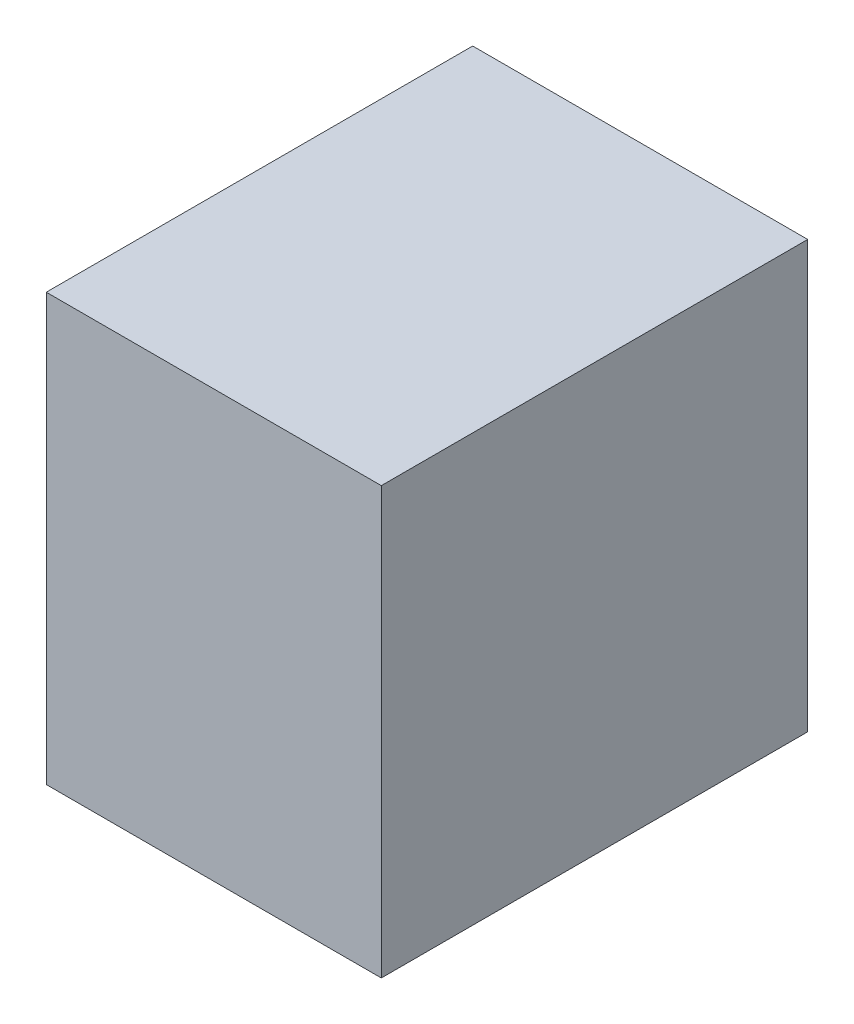
from build123d import *

# Parameters (mm, degrees)
SKETCH_1_W      = 5.5
SKETCH_1_H      = 7
EXTRUDE_1_DEPTH = 7


with BuildPart() as part:
    # 草图1 → 凸台-拉伸1 (new body)
    with BuildSketch(Plane(origin=(0, 0, 0), x_dir=(1, 0, 0), z_dir=(0, 1, 0))):
        with Locations((-7.027777778, 0.414930556)):
            Rectangle(SKETCH_1_W, SKETCH_1_H)
    extrude(amount=EXTRUDE_1_DEPTH)


solid = part.part
